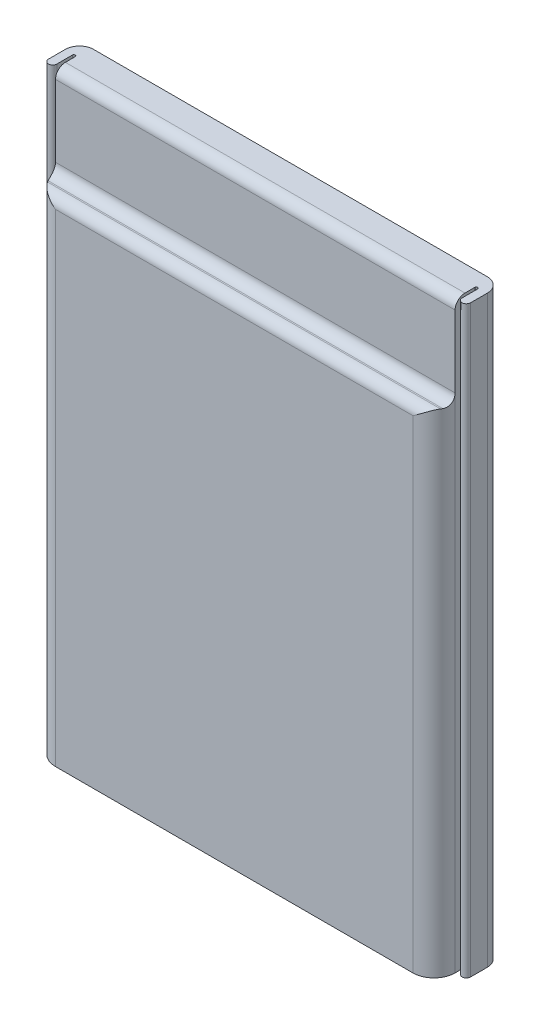
from build123d import *

# Parameters (mm, degrees)
EXTRUDE_1_DEPTH                 = 20.75
CUT_EXTRUDE_1_REACH             = 27.915
CUT_EXTRUDE_1_DIRECTION_2_REACH = 27.915


with BuildPart() as part:
    # Эскиз1 → Бобышка-Вытянуть1 (new, symmetric)
    with BuildSketch(Plane(origin=(0, 0, 0), x_dir=(1, 0, 0), z_dir=(0, 1, 0))):
        with BuildLine():
            Line((-14, 0), (14, 0))
            ThreePointArc((14, 0), (14.707106781, -0.292893219), (15, -1))
            Line((15, -1), (15, -2.2))
            ThreePointArc((15, -2.2), (14.7, -2.5), (14.4, -2.2))
            Line((14.4, -2.2), (14.4, -1.1))
            ThreePointArc((14.4, -1.1), (14.3, -1), (14.2, -1.1))
            Line((14.2, -1.1), (14.2, -2.5))
            ThreePointArc((14.2, -2.5), (13.760660172, -3.560660172), (12.7, -4))
            Line((12.7, -4), (-12.7, -4))
            ThreePointArc((-12.7, -4), (-13.760660172, -3.560660172), (-14.2, -2.5))
            Line((-14.2, -2.5), (-14.2, -1.1))
            ThreePointArc((-14.2, -1.1), (-14.3, -1), (-14.4, -1.1))
            Line((-14.4, -1.1), (-14.4, -2.2))
            ThreePointArc((-14.4, -2.2), (-14.7, -2.5), (-15, -2.2))
            Line((-15, -2.2), (-15, -1))
            ThreePointArc((-15, -1), (-14.707106781, -0.292893219), (-14, 0))
        make_face()
    extrude(amount=EXTRUDE_1_DEPTH, both=True)

    # Эскиз2 → Вырез-Вытянуть1 (cut, up to next)
    with BuildSketch(Plane(origin=(0, 0, 0), x_dir=(0, 0, -1), z_dir=(1, 0, 0)), mode=Mode.PRIVATE) as cut_extrude_1_sk1:
        with BuildLine():
            Line((-2.5, 20.05), (-2.5, 14.95))
            ThreePointArc((-2.5, 14.95), (-2.705025253, 14.455025253), (-3.2, 14.25))
            Line((-3.2, 14.25), (-3.3, 14.25))
            ThreePointArc((-3.3, 14.25), (-3.794974747, 14.044974747), (-4, 13.55))
            Line((-4, 13.55), (-4, 20.75))
            Line((-4, 20.75), (-1.8, 20.75))
            ThreePointArc((-1.8, 20.75), (-2.294974747, 20.544974747), (-2.5, 20.05))
        make_face()
    cut_extrude_1_tool1 = extrude(cut_extrude_1_sk1.sketch, amount=-CUT_EXTRUDE_1_REACH, mode=Mode.PRIVATE) & part.part
    add(cut_extrude_1_tool1.solids().sort_by_distance((0, 17.529673, 3.252998))[0], mode=Mode.SUBTRACT)

    # Эскиз2 → Вырез-Вытянуть1 direction 2 (cut, up to next)
    with BuildSketch(Plane(origin=(0, 0, 0), x_dir=(0, 0, -1), z_dir=(1, 0, 0)), mode=Mode.PRIVATE) as cut_extrude_1_direction_2_sk1:
        with BuildLine():
            Line((-2.5, 20.05), (-2.5, 14.95))
            ThreePointArc((-2.5, 14.95), (-2.705025253, 14.455025253), (-3.2, 14.25))
            Line((-3.2, 14.25), (-3.3, 14.25))
            ThreePointArc((-3.3, 14.25), (-3.794974747, 14.044974747), (-4, 13.55))
            Line((-4, 13.55), (-4, 20.75))
            Line((-4, 20.75), (-1.8, 20.75))
            ThreePointArc((-1.8, 20.75), (-2.294974747, 20.544974747), (-2.5, 20.05))
        make_face()
    cut_extrude_1_direction_2_tool1 = extrude(cut_extrude_1_direction_2_sk1.sketch, amount=CUT_EXTRUDE_1_DIRECTION_2_REACH, mode=Mode.PRIVATE) & part.part
    add(cut_extrude_1_direction_2_tool1.solids().sort_by_distance((0, 17.529673, 3.252998))[0], mode=Mode.SUBTRACT)


solid = part.part
